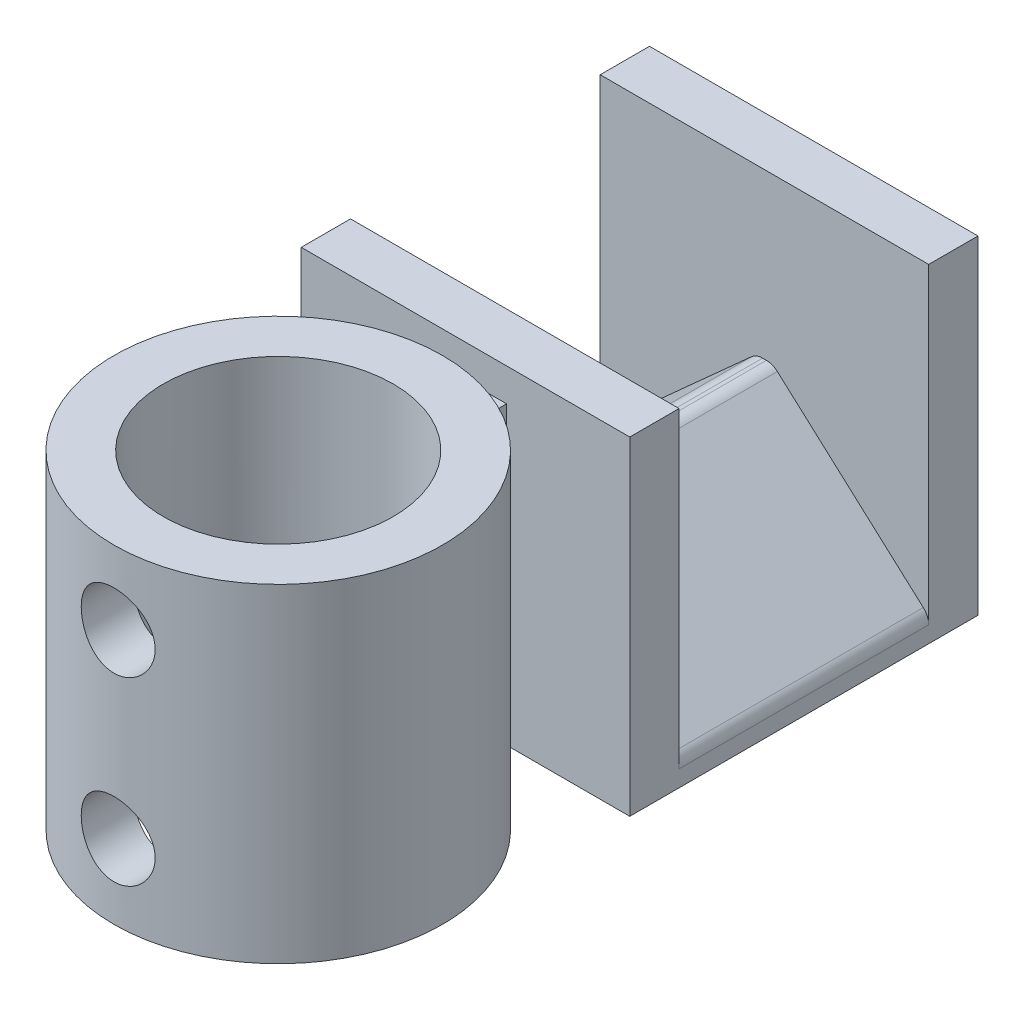
from build123d import *

# Parameters (mm, degrees)
SKETCH2_W                       = 20
SKETCH2_H                       = 10
BOSS_EXTRUDE1_DEPTH             = 7.6
CHAMFER1_SIZE                   = 9.5
CHAMFER1_SIZE2                  = 8.553838421
FILLET3_R                       = 1
SKETCH3_W                       = 20
SKETCH3_H                       = 20
BOSS_EXTRUDE2_DEPTH             = 3
BOSS_EXTRUDE3_REACH             = 22.913
SKETCH6_R                       = 10
SKETCH6_R_2                     = 7
BOSS_EXTRUDE3_DIRECTION_2_REACH = 22.913
BOSS_EXTRUDE4_REACH             = 29.981
BOSS_EXTRUDE4_END_RADIUS        = 10
SKETCH5_W                       = 5
SKETCH5_H                       = 16
CUT_EXTRUDE1_REACH              = 37.516
CUT_EXTRUDE1_END_RADIUS         = 10
SKETCH7_R                       = 2.25


with BuildPart() as part:
    # Sketch2 → Boss-Extrude1 (new, symmetric)
    with BuildSketch(Plane.XY):
        Rectangle(SKETCH2_W, SKETCH2_H)
    extrude(amount=BOSS_EXTRUDE1_DEPTH, both=True)

    # Chamfer1
    chamfer1_edges = [part.edges().sort_by_distance(p)[0] for p in [
        (-10, 5, 0),
        (10, 5, 0),
    ]]
    chamfer1_side = [part.faces().sort_by_distance(p)[0] for p in [
        (0, 5, 0),
    ]]
    chamfer(chamfer1_edges, length=CHAMFER1_SIZE, length2=CHAMFER1_SIZE2, reference=chamfer1_side[0])

    # Fillet3
    fillet3_edges = [part.edges().sort_by_distance(p)[0] for p in [
        (-0.5, 5, 0),
        (0.5, 5, 0),
        (10, -3.553838421, 0),
        (-10, -3.553838421, 0),
    ]]
    fillet(fillet3_edges, radius=FILLET3_R)

    # Sketch3 → Boss-Extrude2 (add)
    with BuildSketch(Plane.XY.offset(7.6)):
        with Locations((0, 5)):
            Rectangle(SKETCH3_W, SKETCH3_H)
    boss_extrude2 = extrude(amount=BOSS_EXTRUDE2_DEPTH)

    # Mirror1: Boss-Extrude2 across plane
    add(boss_extrude2.mirror(Plane.XY))


with BuildPart() as body_2:

    # Boss-Extrude3: up to this face of the body (flat: up to its plane)
    boss_extrude3_end = Plane(part.part.faces().sort_by_distance((0, 15, 9.1))[0])
    # Sketch6 → Boss-Extrude3 (new, up to the picked face)
    with BuildSketch(Plane(origin=(0, 0, 0), x_dir=(1, 0, 0), z_dir=(0, 1, 0)), mode=Mode.PRIVATE) as boss_extrude3_sk1:
        with Locations(Location((0, -22, 0), (0, 0, 90))):
            Circle(SKETCH6_R)
        with Locations(Location((0, -22, 0), (0, 0, 90))):
            Circle(SKETCH6_R_2, mode=Mode.SUBTRACT)
    boss_extrude3_tool1 = split(extrude(boss_extrude3_sk1.sketch, amount=BOSS_EXTRUDE3_REACH, mode=Mode.PRIVATE), bisect_by=boss_extrude3_end, keep=Keep.BOTH, mode=Mode.PRIVATE)
    add(boss_extrude3_tool1.solids().sort_by(Axis((0, 0, 31.717157), (0, 1, 0)))[0])


    # Boss-Extrude3 direction 2: up to this face of the body (flat: up to its plane)
    boss_extrude3_direction_2_end = Plane(part.part.faces().sort_by_distance((0, -5, 0))[0])
    # Sketch6 → Boss-Extrude3 direction 2 (add, up to the picked face)
    with BuildSketch(Plane(origin=(0, 0, 0), x_dir=(1, 0, 0), z_dir=(0, 1, 0)), mode=Mode.PRIVATE) as boss_extrude3_direction_2_sk1:
        with Locations(Location((0, -22, 0), (0, 0, 90))):
            Circle(SKETCH6_R)
        with Locations(Location((0, -22, 0), (0, 0, 90))):
            Circle(SKETCH6_R_2, mode=Mode.SUBTRACT)
    boss_extrude3_direction_2_tool1 = split(extrude(boss_extrude3_direction_2_sk1.sketch, amount=-BOSS_EXTRUDE3_DIRECTION_2_REACH, mode=Mode.PRIVATE), bisect_by=boss_extrude3_direction_2_end, keep=Keep.BOTH, mode=Mode.PRIVATE)
    add(boss_extrude3_direction_2_tool1.solids().sort_by(Axis((0, 0, 31.717157), (0, -1, 0)))[0])


with BuildPart() as part_1:
    add(part.part)

    add(body_2.part)  # Boss-Extrude4 merges body 2
    # Boss-Extrude4: up to this cylinder (the profile starts outside it)
    boss_extrude4_end = Plane(origin=(0, 5, 22), z_dir=(0, -1, 0)) * Cylinder(BOSS_EXTRUDE4_END_RADIUS, 80.962, mode=Mode.PRIVATE)
    # Sketch5 → Boss-Extrude4 (add, up to the surface)
    with BuildSketch(Plane.XY.offset(10.6), mode=Mode.PRIVATE) as boss_extrude4_sk1:
        with Locations((0, 5)):
            Rectangle(SKETCH5_W, SKETCH5_H)
    boss_extrude4_tool1 = extrude(boss_extrude4_sk1.sketch, amount=BOSS_EXTRUDE4_REACH, mode=Mode.PRIVATE) - boss_extrude4_end
    add(boss_extrude4_tool1.solids().sort_by_distance((0, 5, 10.6))[0])

    # Cut-Extrude1: up to this cylinder (the profile starts inside it)
    cut_extrude1_end = Plane(origin=(0, 5, 22), z_dir=(0, -1, 0)) * Cylinder(CUT_EXTRUDE1_END_RADIUS, 107.032, mode=Mode.PRIVATE)
    # Sketch7 → Cut-Extrude1 (cut, up to the surface)
    with BuildSketch(Plane.XY.offset(20), mode=Mode.PRIVATE) as cut_extrude1_sk1:
        with Locations(Location((0, 10.5, 0), (0, 0, 180))):
            Circle(SKETCH7_R)
    cut_extrude1_tool1 = extrude(cut_extrude1_sk1.sketch, amount=CUT_EXTRUDE1_REACH, mode=Mode.PRIVATE) & cut_extrude1_end
    add(cut_extrude1_tool1.solids().sort_by_distance((0, 10.5, 20))[0], mode=Mode.SUBTRACT)
    # Sketch7 → Cut-Extrude1 (cut, up to the surface)
    with BuildSketch(Plane.XY.offset(20), mode=Mode.PRIVATE) as cut_extrude1_sk2:
        with Locations(Location((0, -0.5, 0), (0, 0, 180))):
            Circle(SKETCH7_R)
    cut_extrude1_tool2 = extrude(cut_extrude1_sk2.sketch, amount=CUT_EXTRUDE1_REACH, mode=Mode.PRIVATE) & cut_extrude1_end
    add(cut_extrude1_tool2.solids().sort_by_distance((0, -0.5, 20))[0], mode=Mode.SUBTRACT)


solid = part_1.part
